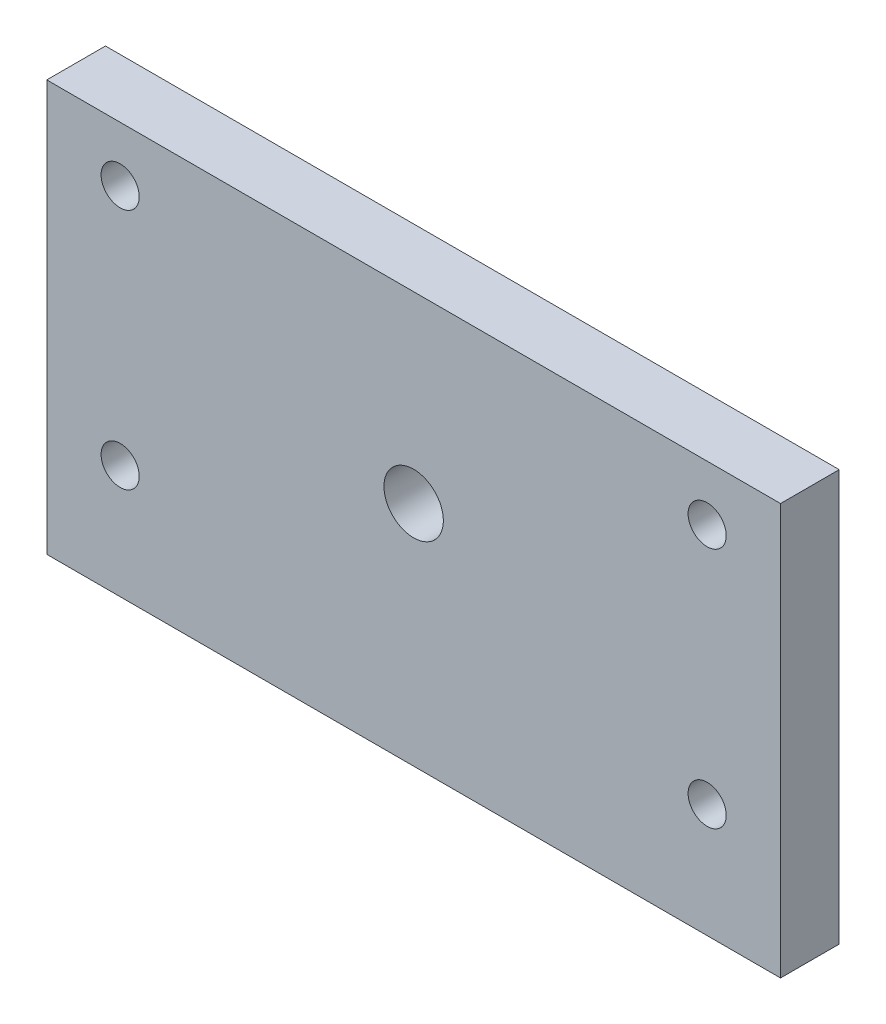
from build123d import *

# Parameters (mm, degrees)
IZIM1_W                     = 100
IZIM1_H                     = 56
IZIM1_R                     = 4.05
Y_KSEKLIK_EKSTR_ZYON1_DEPTH = 8
IZIM3_R                     = 2.6
KES_EKSTR_ZYON2_DEPTH       = 10


with BuildPart() as part:
    # Çizim1 → Yükseklik-Ekstrüzyon1 (new body)
    with BuildSketch(Plane.XY):
        with Locations((7.377917159, -1.029772329)):
            Rectangle(IZIM1_W, IZIM1_H)
        with Locations((7.377917159, 1.970227671)):
            Circle(IZIM1_R, mode=Mode.SUBTRACT)
    extrude(amount=Y_KSEKLIK_EKSTR_ZYON1_DEPTH)

    # Çizim3 → Kes-Ekstrüzyon2 (cut)
    with BuildSketch(Plane.XY.offset(8)):
        with Locations((-32.622082841, 19.470227671)):
            Circle(IZIM3_R)
        with Locations((47.377917159, 19.470227671)):
            Circle(IZIM3_R)
        with Locations((47.377917159, -13.529772329)):
            Circle(IZIM3_R)
        with Locations((-32.622082841, -13.529772329)):
            Circle(IZIM3_R)
    extrude(amount=-KES_EKSTR_ZYON2_DEPTH, mode=Mode.SUBTRACT)


solid = part.part
